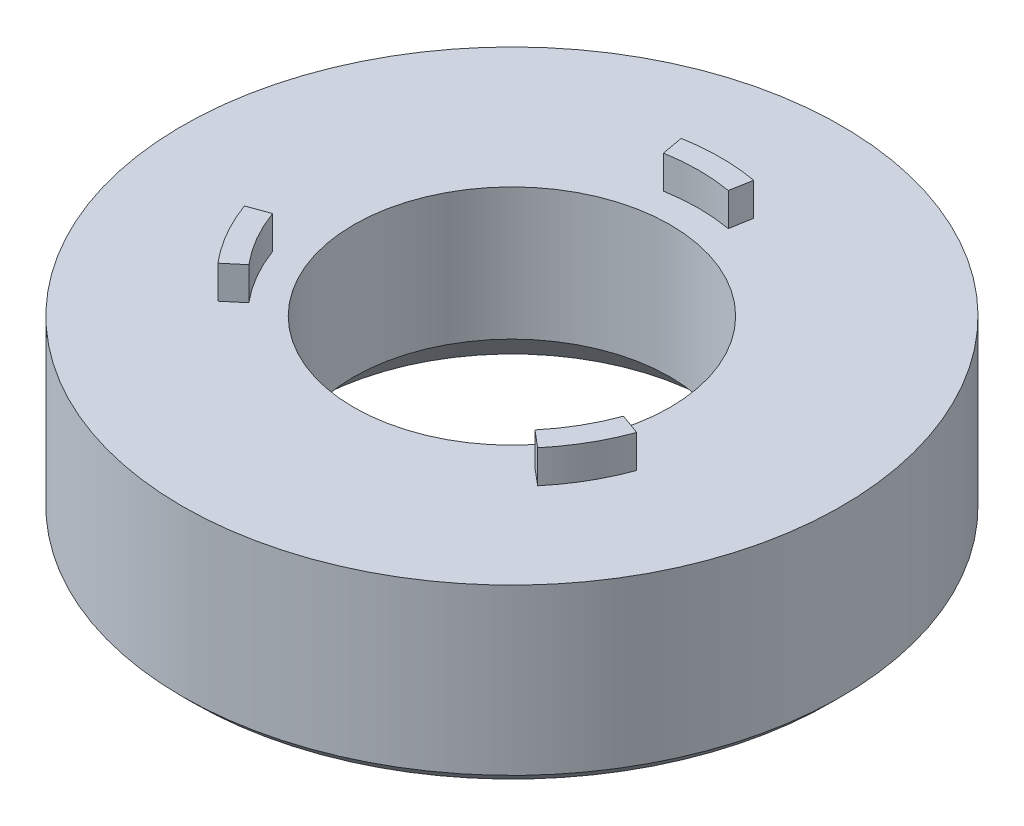
from build123d import *

# Parameters (mm, degrees)
SKETCH_1_R               = 15
SKETCH_1_R_2             = 7.2
EXTRUDE_1_DEPTH          = 8
CHAMFER_1_SIZE           = 0.5
CHAMFER_2_SIZE           = 2
EXTRUDE_2_DEPTH          = 1.5
PATTERN_CIRCULAR_1_COUNT = 3


with BuildPart() as part:
    # 草图1 → 凸台-拉伸1 (new body)
    with BuildSketch(Plane(origin=(0, 0, 0), x_dir=(1, 0, 0), z_dir=(0, 1, 0))):
        with Locations(Location((0, 0, 0), (0, 0, 270))):
            Circle(SKETCH_1_R)
        with Locations(Location((0, 0, 0), (0, 0, 270))):
            Circle(SKETCH_1_R_2, mode=Mode.SUBTRACT)
    extrude(amount=EXTRUDE_1_DEPTH)

    # 倒角1
    chamfer_1_edges = [part.edges().sort_by_distance(p)[0] for p in [
        (0, 0, -15),
    ]]
    chamfer(chamfer_1_edges, length=CHAMFER_1_SIZE)

    # 倒角2
    chamfer_2_edges = [part.edges().sort_by_distance(p)[0] for p in [
        (0, 0, -7.2),
    ]]
    chamfer(chamfer_2_edges, length=CHAMFER_2_SIZE)

    # 草图2 → 凸台-拉伸2 (add)
    with BuildSketch(Plane(origin=(0, 8, 0), x_dir=(1, 0, 0), z_dir=(0, 1, 0))):
        with BuildLine():
            Line((1.649657688, 9.355673654), (1.47600951, 8.370865901))
            ThreePointArc((1.47600951, 8.370865901), (0, 8.5), (-1.47600951, 8.370865901))
            Line((-1.47600951, 8.370865901), (-1.649657688, 9.355673654))
            ThreePointArc((-1.649657688, 9.355673654), (0, 9.5), (1.649657688, 9.355673654))
        make_face()
    extrude_2 = extrude(amount=EXTRUDE_2_DEPTH)

    # 阵列(圆周)1: 凸台-拉伸2 ×3 about axis
    pattern_circular_1_axis = Axis((0, 0, 0), (0, 1, 0))
    for i in range(1, PATTERN_CIRCULAR_1_COUNT):
        add(extrude_2.rotate(pattern_circular_1_axis, i * 360 / PATTERN_CIRCULAR_1_COUNT))


solid = part.part
